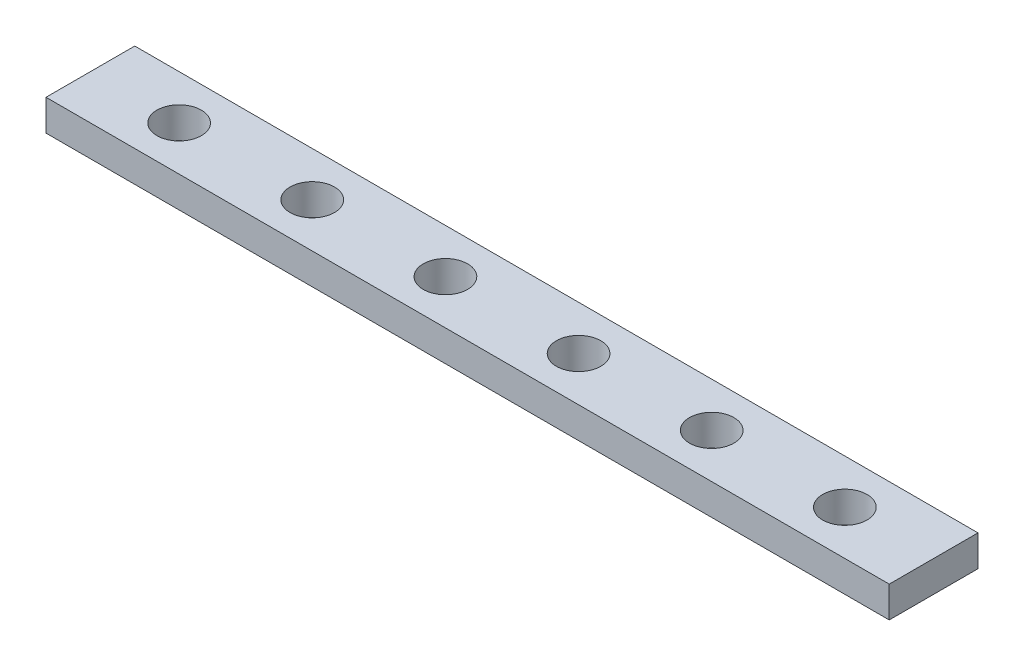
from build123d import *

# Parameters (mm, degrees)
SKETCH1_W           = 150
SKETCH1_H           = 10
SKETCH1_R           = 2.5
BOSS_EXTRUDE1_DEPTH = 6
SKETCH2_W           = 10
SKETCH2_H           = 6
CUT_EXTRUDE1_DEPTH  = 55
SKETCH3_W           = 95
SKETCH3_H           = 10
CUT_EXTRUDE2_DEPTH  = 2.5


with BuildPart() as part:
    # Sketch1 → Boss-Extrude1 (new body)
    with BuildSketch(Plane(origin=(0, 0, 0), x_dir=(1, 0, 0), z_dir=(0, 1, 0))):
        with Locations((75, 5)):
            Rectangle(SKETCH1_W, SKETCH1_H)
        with Locations(Location((145, 5, 0), (0, 0, 270))):
            Circle(SKETCH1_R, mode=Mode.SUBTRACT)
        with Locations(Location((130, 5, 0), (0, 0, 270))):
            Circle(SKETCH1_R, mode=Mode.SUBTRACT)
        with Locations(Location((115, 5, 0), (0, 0, 270))):
            Circle(SKETCH1_R, mode=Mode.SUBTRACT)
        with Locations(Location((100, 5, 0), (0, 0, 270))):
            Circle(SKETCH1_R, mode=Mode.SUBTRACT)
        with Locations(Location((85, 5, 0), (0, 0, 270))):
            Circle(SKETCH1_R, mode=Mode.SUBTRACT)
        with Locations(Location((70, 5, 0), (0, 0, 270))):
            Circle(SKETCH1_R, mode=Mode.SUBTRACT)
        with Locations(Location((55, 5, 0), (0, 0, 270))):
            Circle(SKETCH1_R, mode=Mode.SUBTRACT)
        with Locations(Location((40, 5, 0), (0, 0, 270))):
            Circle(SKETCH1_R, mode=Mode.SUBTRACT)
        with Locations(Location((25, 5, 0), (0, 0, 270))):
            Circle(SKETCH1_R, mode=Mode.SUBTRACT)
        with Locations(Location((10, 5, 0), (0, 0, 270))):
            Circle(SKETCH1_R, mode=Mode.SUBTRACT)
    extrude(amount=BOSS_EXTRUDE1_DEPTH)

    # Sketch2 → Cut-Extrude1 (cut)
    with BuildSketch(Plane(origin=(150, 0, 0), x_dir=(0, 0, -1), z_dir=(1, 0, 0))):
        with Locations((5, 3)):
            Rectangle(SKETCH2_W, SKETCH2_H)
    extrude(amount=-CUT_EXTRUDE1_DEPTH, mode=Mode.SUBTRACT)

    # Sketch3 → Cut-Extrude2 (cut)
    with BuildSketch(Plane(origin=(0, 6, 0), x_dir=(1, 0, 0), z_dir=(0, 1, 0))):
        with Locations((47.5, 5)):
            Rectangle(SKETCH3_W, SKETCH3_H)
    extrude(amount=-CUT_EXTRUDE2_DEPTH, mode=Mode.SUBTRACT)


solid = part.part
